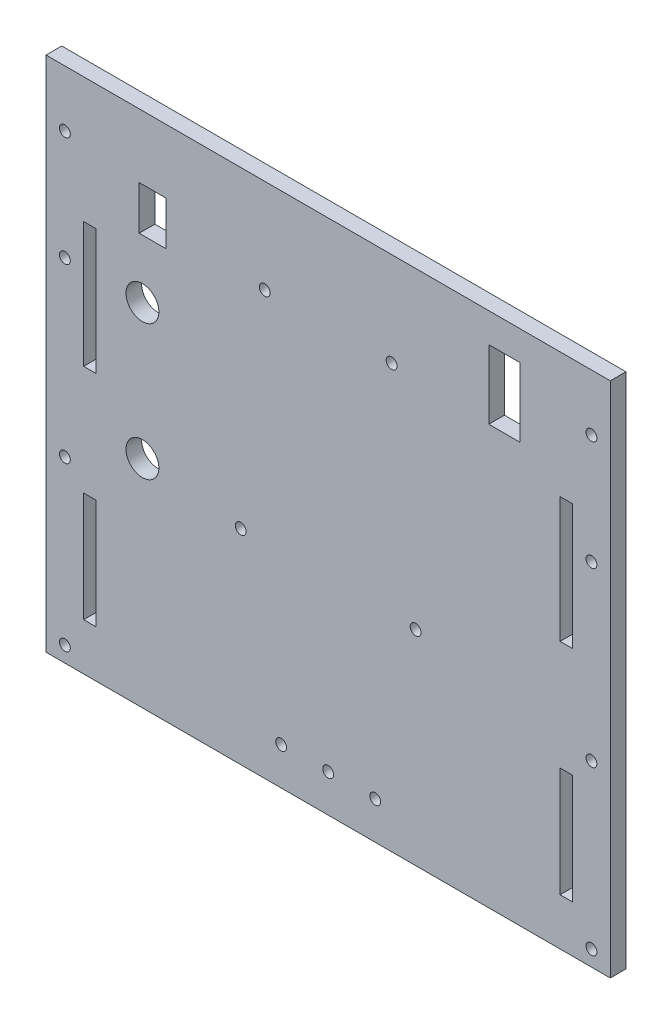
from build123d import *

# Parameters (mm, degrees)
SKETCH1_W           = 180
SKETCH1_H           = 165
BOSS_EXTRUDE1_DEPTH = 5
SKETCH2_W           = 4
SKETCH2_H           = 40
CUT_EXTRUDE1_DEPTH  = 5
SKETCH2_3_W         = 4
SKETCH2_3_H         = 35
CUT_EXTRUDE2_DEPTH  = 5
SKETCH3_R           = 1.73
CUT_EXTRUDE3_DEPTH  = 5
SKETCH4_R           = 1.73
CUT_EXTRUDE4_DEPTH  = 5
CUT_EXTRUDE6_DEPTH  = 5
SKETCH5_4_R         = 5.25
SKETCH5_4_W         = 8.6
SKETCH5_4_H         = 14
CUT_EXTRUDE7_DEPTH  = 5
SKETCH6_R           = 1.73
CUT_EXTRUDE8_DEPTH  = 5


with BuildPart() as part:
    # Sketch1 → Boss-Extrude1 (new body)
    with BuildSketch(Plane.XY):
        Rectangle(SKETCH1_W, SKETCH1_H)
    extrude(amount=BOSS_EXTRUDE1_DEPTH)

    # Sketch2 → Cut-Extrude1 (cut)
    with BuildSketch(Plane.XY.offset(5)):
        with Locations((-76, 22.5)):
            Rectangle(SKETCH2_W, SKETCH2_H)
    cut_extrude1 = extrude(amount=-CUT_EXTRUDE1_DEPTH, mode=Mode.SUBTRACT)

    # Sketch2<3> → Cut-Extrude2 (cut)
    with BuildSketch(Plane.XY.offset(5)):
        with Locations((-76, -50)):
            Rectangle(SKETCH2_3_W, SKETCH2_3_H)
    cut_extrude2 = extrude(amount=-CUT_EXTRUDE2_DEPTH, mode=Mode.SUBTRACT)

    # Mirror1: Cut-Extrude1, Cut-Extrude2 across plane
    add(cut_extrude1.mirror(Plane(origin=(0, 0, 0), x_dir=(0, 0, 1), z_dir=(1, 0, 0))), mode=Mode.SUBTRACT)
    add(cut_extrude2.mirror(Plane(origin=(0, 0, 0), x_dir=(0, 0, 1), z_dir=(1, 0, 0))), mode=Mode.SUBTRACT)

    # Sketch3 → Cut-Extrude3 (cut)
    with BuildSketch(Plane(origin=(0, 0, 0), x_dir=(-1, 0, 0), z_dir=(0, 0, -1))):
        with Locations((-84, -77.5)):
            Circle(SKETCH3_R)
        with Locations((-84, -25.5)):
            Circle(SKETCH3_R)
        with Locations((-84, 29.5)):
            Circle(SKETCH3_R)
        with Locations((-84, 64.5)):
            Circle(SKETCH3_R)
    cut_extrude3 = extrude(amount=-CUT_EXTRUDE3_DEPTH, mode=Mode.SUBTRACT)

    # Mirror2: Cut-Extrude3 across plane
    add(cut_extrude3.mirror(Plane(origin=(0, 0, 0), x_dir=(0, 0, 1), z_dir=(1, 0, 0))), mode=Mode.SUBTRACT)

    # Sketch4 → Cut-Extrude4 (cut)
    with BuildSketch(Plane(origin=(0, 0, 0), x_dir=(-1, 0, 0), z_dir=(0, 0, -1))):
        with Locations((-20.24, 52.5)):
            Circle(SKETCH4_R)
        with Locations((20.24, 52.5)):
            Circle(SKETCH4_R)
        with Locations((-27.9, -17.28)):
            Circle(SKETCH4_R)
        with Locations((27.9, -17.28)):
            Circle(SKETCH4_R)
    extrude(amount=-CUT_EXTRUDE4_DEPTH, mode=Mode.SUBTRACT)

    # Sketch5 → Cut-Extrude6 (cut)
    with BuildSketch(Plane(origin=(0, 0, 0), x_dir=(-1, 0, 0), z_dir=(0, 0, -1))):
        Polygon((-56.244150745, 73.117395969), (-61.244150745, 73.117395969), (-61.244150745, 51.117395969), (-51.244150745, 51.117395969), (-51.244150745, 73.117395969), align=None)
    extrude(amount=-CUT_EXTRUDE6_DEPTH, mode=Mode.SUBTRACT)

    # Sketch5<4> → Cut-Extrude7 (cut)
    with BuildSketch(Plane(origin=(0, 0, 0), x_dir=(-1, 0, 0), z_dir=(0, 0, -1))):
        with Locations((59.260446157, 29.480985143)):
            Circle(SKETCH5_4_R)
        with Locations((59.260446157, -13.621859261)):
            Circle(SKETCH5_4_R)
        with Locations((56, 55.117395969)):
            Rectangle(SKETCH5_4_W, SKETCH5_4_H)
    extrude(amount=-CUT_EXTRUDE7_DEPTH, mode=Mode.SUBTRACT)

    # Sketch6 → Cut-Extrude8 (cut)
    with BuildSketch(Plane(origin=(0, 0, 0), x_dir=(-1, 0, 0), z_dir=(0, 0, -1))):
        with Locations((0, -70.5)):
            Circle(SKETCH6_R)
        with Locations((-15, -70.5)):
            Circle(SKETCH6_R)
        with Locations((15, -70.5)):
            Circle(SKETCH6_R)
    extrude(amount=-CUT_EXTRUDE8_DEPTH, mode=Mode.SUBTRACT)


solid = part.part
